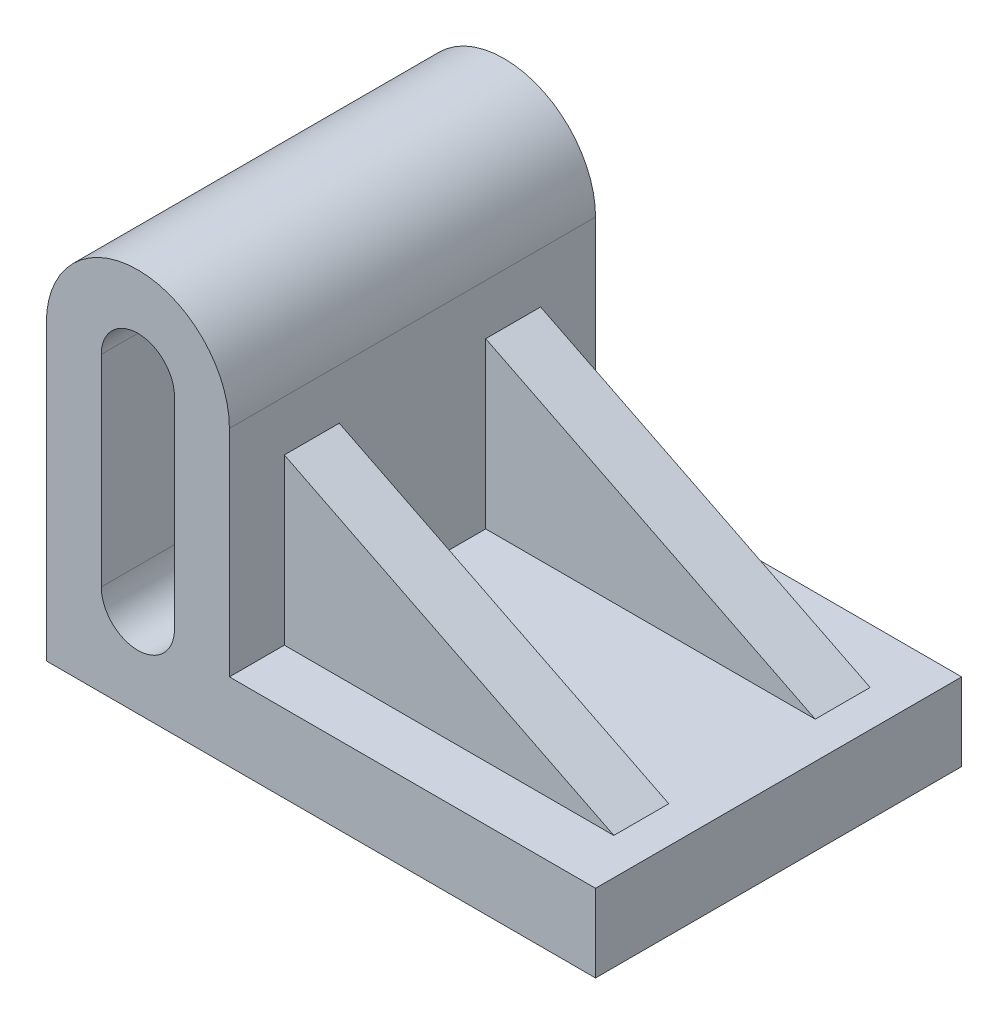
from build123d import *

# Parameters (mm, degrees)
BOSS_EXTRUDE2_DEPTH      = 50
BOSS_EXTRUDE2_DEPTH_BACK = 50
CUT_EXTRUDE2_DEPTH       = 209.62646045
BOSS_EXTRUDE3_DEPTH      = 35
BOSS_EXTRUDE3_DEPTH_BACK = 35
SKETCH10_W               = 99.044902454
SKETCH10_H               = 40
CUT_EXTRUDE3_DEPTH       = 179.937459443


with BuildPart() as part:
    # Sketch1 → Boss-Extrude2 (new, two sides: drawn at the far end of the back side and taken through both)
    with BuildSketch(Plane.XY.offset(-BOSS_EXTRUDE2_DEPTH_BACK)):
        with BuildLine():
            Line((0, 0), (150, 0))
            Line((150, 0), (150, 21.222828934))
            Line((150, 21.222828934), (50, 21.222828934))
            Line((50, 21.222828934), (50, 80))
            ThreePointArc((50, 80), (25, 105), (0, 80))
            Line((0, 80), (0, 0))
        make_face()
    extrude(amount=BOSS_EXTRUDE2_DEPTH + BOSS_EXTRUDE2_DEPTH_BACK)

    # Sketch7 → Cut-Extrude2 (cut, through all)
    with BuildSketch(Plane.XY.offset(50)):
        with BuildLine():
            Line((35, 80), (35, 25))
            ThreePointArc((35, 25), (25, 15), (15, 25))
            Line((15, 25), (15, 80))
            ThreePointArc((15, 80), (25, 90), (35, 80))
        make_face()
    extrude(amount=-CUT_EXTRUDE2_DEPTH, mode=Mode.SUBTRACT)

    # Sketch9 → Boss-Extrude3 (add, two sides: drawn at the far end of the back side and taken through both)
    with BuildSketch(Plane.XY.offset(-BOSS_EXTRUDE3_DEPTH_BACK)):
        Polygon((50, 66.222828934), (50, 21.222828934), (140, 21.222828934), align=None)
    extrude(amount=BOSS_EXTRUDE3_DEPTH + BOSS_EXTRUDE3_DEPTH_BACK)

    # Sketch10 → Cut-Extrude3 (cut, through all)
    with BuildSketch(Plane(origin=(0, 21.222828934, 0), x_dir=(1, 0, 0), z_dir=(0, 1, 0))):
        with Locations((99.522451227, 0)):
            Rectangle(SKETCH10_W, SKETCH10_H)
    extrude(amount=CUT_EXTRUDE3_DEPTH, mode=Mode.SUBTRACT)


solid = part.part
